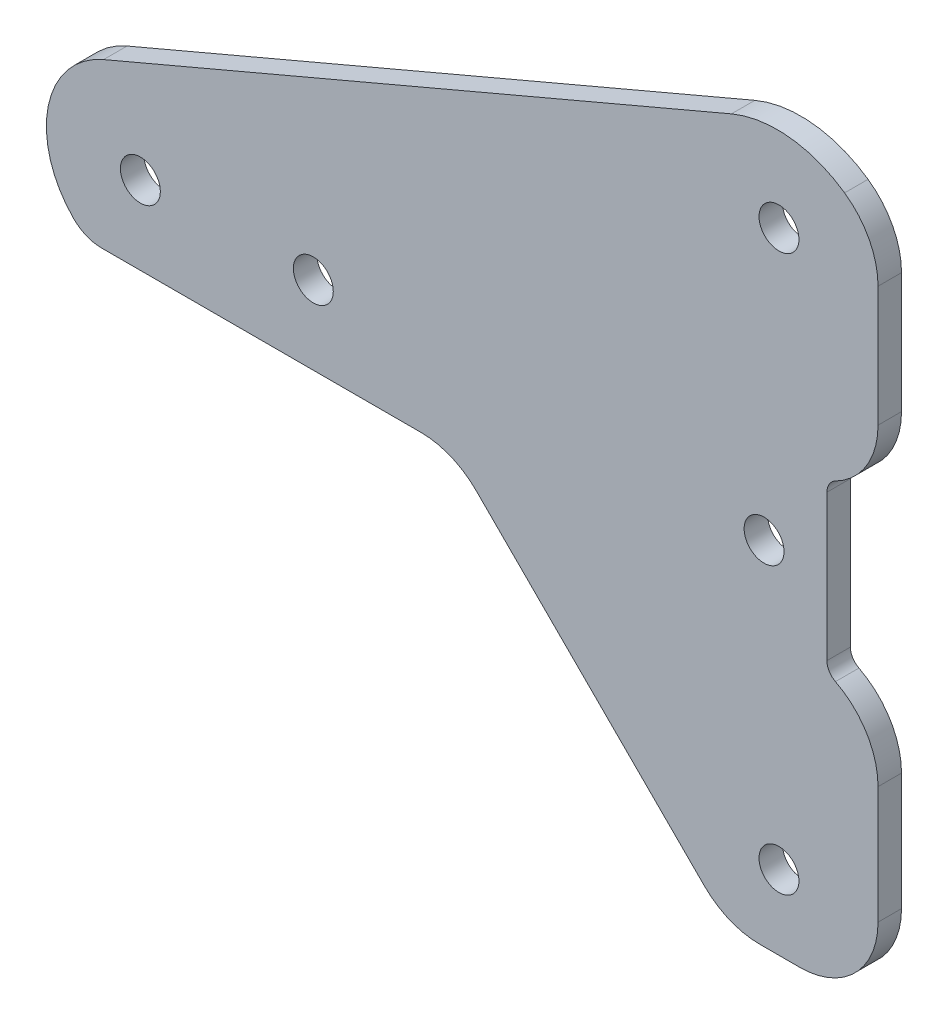
from build123d import *

# Parameters (mm, degrees)
SKETCH1_R           = 2.55
BOSS_EXTRUDE2_DEPTH = 3


with BuildPart() as part:
    # Sketch1 → Boss-Extrude2 (new body)
    with BuildSketch(Plane.XY):
        with BuildLine():
            Line((0, 20.000781807), (0, 35.380781807))
            ThreePointArc((0, 35.380781807), (-1.131516477, 40.001387827), (-4.27, 43.576335479))
            ThreePointArc((-4.27, 43.576335479), (-11.306226361, 46.201792614), (-18.733195752, 45.087507084))
            Line((-18.733195752, 45.087507084), (-98.964962039, 10.981553375))
            ThreePointArc((-98.964962039, 10.981553375), (-106.051053982, 2.24930594), (-102.807556787, -8.518450105))
            ThreePointArc((-102.807556787, -8.518450105), (-101.178529417, -9.616994075), (-99.252006076, -10.003046978))
            Line((-99.252006076, -10.003046978), (-58.412006076, -10.003046978))
            ThreePointArc((-58.412006076, -10.003046978), (-54.585171753, -10.764251653), (-51.340938265, -12.931979166))
            Line((-51.340938265, -12.931979166), (-22.201067812, -42.071849618))
            ThreePointArc((-22.201067812, -42.071849618), (-18.956834324, -44.239577132), (-15.13, -45.000781807))
            Line((-15.13, -45.000781807), (-10, -45.000781807))
            ThreePointArc((-10, -45.000781807), (-2.928932188, -42.071849618), (0, -35.000781807))
            Line((0, -35.000781807), (0, -20.000781807))
            ThreePointArc((0, -20.000781807), (-1.468196752, -14.784621022), (-5.441666667, -11.100130301))
            ThreePointArc((-5.441666667, -11.100130301), (-6.23636065, -10.363232157), (-6.53, -9.32))
            Line((-6.53, -9.32), (-6.53, 9.32))
            ThreePointArc((-6.53, 9.32), (-6.23636065, 10.363232157), (-5.441666667, 11.100130301))
            ThreePointArc((-5.441666667, 11.100130301), (-1.468196752, 14.784621022), (0, 20.000781807))
        make_face()
        with Locations((-94.264328129, -0.003046978)):
            Circle(SKETCH1_R, mode=Mode.SUBTRACT)
        with Locations((-72.164328129, -0.003046978)):
            Circle(SKETCH1_R, mode=Mode.SUBTRACT)
        with Locations((-14.564328129, -0.003046978)):
            Circle(SKETCH1_R, mode=Mode.SUBTRACT)
        with Locations((-12.66, 35.499218193)):
            Circle(SKETCH1_R, mode=Mode.SUBTRACT)
        with Locations((-12.66, -35.500781807)):
            Circle(SKETCH1_R, mode=Mode.SUBTRACT)
    extrude(amount=BOSS_EXTRUDE2_DEPTH)


solid = part.part
